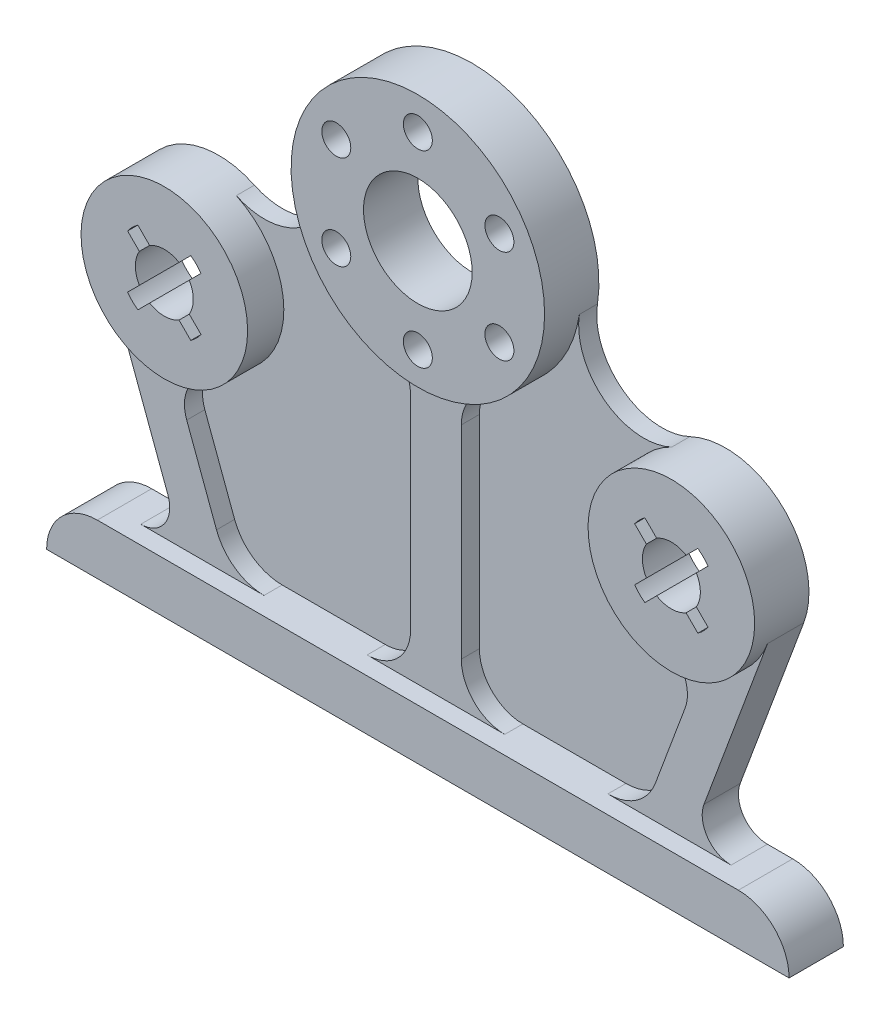
from build123d import *

# Parameters (mm, degrees)
EXTRUDE_1_DEPTH   = 5
EXTRUDE_1_2_DEPTH = 5
SKETCH_1_3_R      = 35
SKETCH_1_3_R_2    = 4
SKETCH_1_3_R_3    = 15
SKETCH_1_3_R_4    = 23
EXTRUDE_2_DEPTH   = 15
EXTRUDE_3_DEPTH   = 10


with BuildPart() as part:
    # Эскиз1 → Бобышка-Вытянуть1 (new body)
    with BuildSketch(Plane.XY):
        with BuildLine():
            Line((-7, -99), (-7, -42.98837052))
            ThreePointArc((-7, -42.98837052), (-8.944833021, -36.439048645), (-14.14893617, -32.012616345))
            ThreePointArc((-14.14893617, -32.012616345), (-27.803487019, -21.259494575), (-34.601893463, -5.263930923))
            ThreePointArc((-34.601893463, -5.263930923), (-41.662021509, -22.419519283), (-60.125232147, -24.227687662))
            ThreePointArc((-60.125232147, -24.227687662), (-47.040096479, -46.357508857), (-62.641809124, -66.791214446))
            ThreePointArc((-62.641809124, -66.791214446), (-68.470432654, -71.964706785), (-68.815739838, -79.750503994))
            Line((-68.815739838, -79.750503994), (-60.588648114, -101.878787879))
            ThreePointArc((-60.588648114, -101.878787879), (-55.456771013, -108.495717253), (-47.466246321, -111))
            Line((-47.466246321, -111), (-19, -111))
            ThreePointArc((-19, -111), (-10.514718626, -107.485281374), (-7, -99))
        make_face()
    extrude(amount=EXTRUDE_1_DEPTH)



with BuildPart() as body_2:
    # Эскиз1 → Extrude 1 2 (new body)
    with BuildSketch(Plane.XY):
        with BuildLine():
            ThreePointArc((34.601893463, -5.263930923), (27.803487019, -21.259494575), (14.14893617, -32.012616345))
            ThreePointArc((14.14893617, -32.012616345), (8.944833021, -36.439048645), (7, -42.98837052))
            Line((7, -42.98837052), (7, -99))
            ThreePointArc((7, -99), (10.514718626, -107.485281374), (19, -111))
            Line((19, -111), (47.466246321, -111))
            ThreePointArc((47.466246321, -111), (55.456771013, -108.495717253), (60.588648114, -101.878787879))
            Line((60.588648114, -101.878787879), (68.815739838, -79.750503994))
            ThreePointArc((68.815739838, -79.750503994), (68.470432654, -71.964706785), (62.641809124, -66.791214446))
            ThreePointArc((62.641809124, -66.791214446), (47.040096479, -46.357508857), (60.125232147, -24.227687662))
            ThreePointArc((60.125232147, -24.227687662), (41.662021509, -22.419519283), (34.601893463, -5.263930923))
        make_face()
    extrude(amount=EXTRUDE_1_2_DEPTH)


with BuildPart() as part_1:
    add(part.part)

    add(body_2.part)  # Бобышка-Вытянуть2 merges body 2
    # Эскиз1<3> → Бобышка-Вытянуть2 (add)
    # profile 1 of 4: a face of its own
    with BuildSketch(Plane.XY):
        Circle(SKETCH_1_3_R)
        with Locations((0, -26)):
            Circle(SKETCH_1_3_R_2, mode=Mode.SUBTRACT)
        with Locations((-22.516660498, -13)):
            Circle(SKETCH_1_3_R_2, mode=Mode.SUBTRACT)
        Circle(SKETCH_1_3_R_3, mode=Mode.SUBTRACT)
        with Locations((-22.516660498, 13)):
            Circle(SKETCH_1_3_R_2, mode=Mode.SUBTRACT)
        with Locations((0, 26)):
            Circle(SKETCH_1_3_R_2, mode=Mode.SUBTRACT)
        with Locations((22.516660498, -13)):
            Circle(SKETCH_1_3_R_2, mode=Mode.SUBTRACT)
        with Locations((22.516660498, 13)):
            Circle(SKETCH_1_3_R_2, mode=Mode.SUBTRACT)
    # profile 2 of 4: a face of its own
    with BuildSketch(Plane.XY):
        with BuildLine():
            Line((88.5, -111), (-88.5, -111))
            ThreePointArc((-88.5, -111), (-98.399494937, -115.100505063), (-102.5, -125))
            Line((-102.5, -125), (102.5, -125))
            ThreePointArc((102.5, -125), (98.399494937, -115.100505063), (88.5, -111))
        make_face()
    # profile 3 of 4: a face of its own
    with BuildSketch(Plane.XY):
        with Locations((-70, -45)):
            Circle(SKETCH_1_3_R_4)
        with BuildLine():
            ThreePointArc((-59.860822254, -52.310750621), (-61.161165235, -53.838834765), (-62.689249379, -55.139177746))
            Line((-62.689249379, -55.139177746), (-65.936987987, -51.891439137))
            ThreePointArc((-65.936987987, -51.891439137), (-70, -53), (-74.063012013, -51.891439137))
            Line((-74.063012013, -51.891439137), (-77.310750621, -55.139177746))
            ThreePointArc((-77.310750621, -55.139177746), (-78.838834765, -53.838834765), (-80.139177746, -52.310750621))
            Line((-80.139177746, -52.310750621), (-76.891439137, -49.063012013))
            ThreePointArc((-76.891439137, -49.063012013), (-78, -45), (-76.891439137, -40.936987987))
            Line((-76.891439137, -40.936987987), (-80.139177746, -37.689249379))
            ThreePointArc((-80.139177746, -37.689249379), (-78.838834765, -36.161165235), (-77.310750621, -34.860822254))
            Line((-77.310750621, -34.860822254), (-74.063012013, -38.108560863))
            ThreePointArc((-74.063012013, -38.108560863), (-70, -37), (-65.936987987, -38.108560863))
            Line((-65.936987987, -38.108560863), (-62.689249379, -34.860822254))
            ThreePointArc((-62.689249379, -34.860822254), (-61.161165235, -36.161165235), (-59.860822254, -37.689249379))
            Line((-59.860822254, -37.689249379), (-63.108560863, -40.936987987))
            ThreePointArc((-63.108560863, -40.936987987), (-62, -45), (-63.108560863, -49.063012013))
            Line((-63.108560863, -49.063012013), (-59.860822254, -52.310750621))
        make_face(mode=Mode.SUBTRACT)
    # profile 4 of 4: a face of its own
    with BuildSketch(Plane.XY):
        with Locations((70, -45)):
            Circle(SKETCH_1_3_R_4)
        with BuildLine():
            ThreePointArc((59.860822254, -37.689249379), (61.161165235, -36.161165235), (62.689249379, -34.860822254))
            Line((62.689249379, -34.860822254), (65.936987987, -38.108560863))
            ThreePointArc((65.936987987, -38.108560863), (70, -37), (74.063012013, -38.108560863))
            Line((74.063012013, -38.108560863), (77.310750621, -34.860822254))
            ThreePointArc((77.310750621, -34.860822254), (78.838834765, -36.161165235), (80.139177746, -37.689249379))
            Line((80.139177746, -37.689249379), (76.891439137, -40.936987987))
            ThreePointArc((76.891439137, -40.936987987), (78, -45), (76.891439137, -49.063012013))
            Line((76.891439137, -49.063012013), (80.139177746, -52.310750621))
            ThreePointArc((80.139177746, -52.310750621), (78.838834765, -53.838834765), (77.310750621, -55.139177746))
            Line((77.310750621, -55.139177746), (74.063012013, -51.891439137))
            ThreePointArc((74.063012013, -51.891439137), (70, -53), (65.936987987, -51.891439137))
            Line((65.936987987, -51.891439137), (62.689249379, -55.139177746))
            ThreePointArc((62.689249379, -55.139177746), (61.161165235, -53.838834765), (59.860822254, -52.310750621))
            Line((59.860822254, -52.310750621), (63.108560863, -49.063012013))
            ThreePointArc((63.108560863, -49.063012013), (62, -45), (63.108560863, -40.936987987))
            Line((63.108560863, -40.936987987), (59.860822254, -37.689249379))
        make_face(mode=Mode.SUBTRACT)
    extrude(amount=EXTRUDE_2_DEPTH)

    # Эскиз1<4> → Бобышка-Вытянуть3 (add)
    with BuildSketch(Plane.XY):
        with BuildLine():
            ThreePointArc((-14.14893617, -32.012616345), (-8.944833021, -36.439048645), (-7, -42.98837052))
            Line((-7, -42.98837052), (-7, -99))
            ThreePointArc((-7, -99), (-10.514718626, -107.485281374), (-19, -111))
            Line((-19, -111), (19, -111))
            ThreePointArc((19, -111), (10.514718626, -107.485281374), (7, -99))
            Line((7, -99), (7, -42.98837052))
            ThreePointArc((7, -42.98837052), (8.944833021, -36.439048645), (14.14893617, -32.012616345))
            ThreePointArc((14.14893617, -32.012616345), (0, -35), (-14.14893617, -32.012616345))
        make_face()
        with BuildLine():
            Line((-81.509349081, -111), (-47.466246321, -111))
            ThreePointArc((-47.466246321, -111), (-55.456771013, -108.495717253), (-60.588648114, -101.878787879))
            Line((-60.588648114, -101.878787879), (-68.815739838, -79.750503994))
            ThreePointArc((-68.815739838, -79.750503994), (-68.470432654, -71.964706785), (-62.641809124, -66.791214446))
            ThreePointArc((-62.641809124, -66.791214446), (-79.892182066, -65.764024994), (-91.558231518, -53.015151515))
            Line((-91.558231518, -53.015151515), (-74.010833771, -100.212121212))
            ThreePointArc((-74.010833771, -100.212121212), (-74.940367794, -107.56601411), (-81.509349081, -111))
        make_face()
        with BuildLine():
            ThreePointArc((60.588648114, -101.878787879), (55.456771013, -108.495717253), (47.466246321, -111))
            Line((47.466246321, -111), (81.509349081, -111))
            ThreePointArc((81.509349081, -111), (74.940367794, -107.56601411), (74.010833771, -100.212121212))
            Line((74.010833771, -100.212121212), (91.558231518, -53.015151515))
            ThreePointArc((91.558231518, -53.015151515), (79.892182066, -65.764024994), (62.641809124, -66.791214446))
            ThreePointArc((62.641809124, -66.791214446), (68.470432654, -71.964706785), (68.815739838, -79.750503994))
            Line((68.815739838, -79.750503994), (60.588648114, -101.878787879))
        make_face()
    extrude(amount=EXTRUDE_3_DEPTH)


solid = part_1.part
